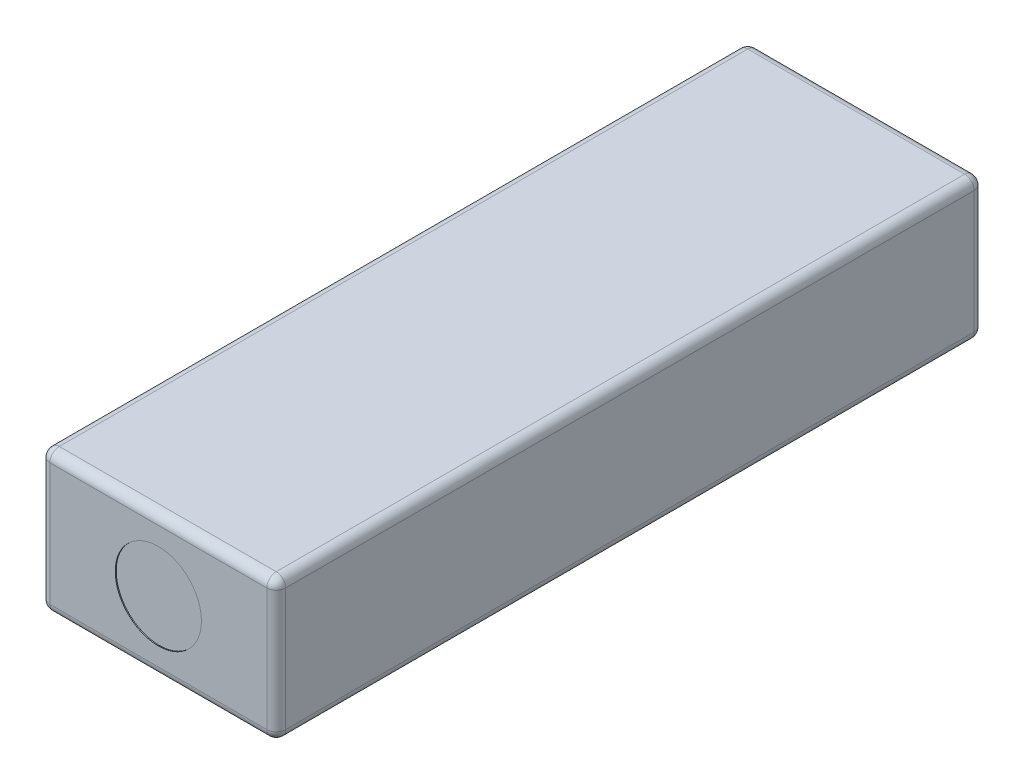
from build123d import *

# Parameters (mm, degrees)
SKETCH2_W           = 50
SKETCH2_H           = 150
BOSS_EXTRUDE1_DEPTH = 30
FILLET1_R           = 2
SKETCH3_R           = 9.140090322
CUT_EXTRUDE1_DEPTH  = 0.2


with BuildPart() as part:
    # Sketch2 → Boss-Extrude1 (new body)
    with BuildSketch(Plane(origin=(0, 0, 0), x_dir=(1, 0, 0), z_dir=(0, 1, 0))):
        Rectangle(SKETCH2_W, SKETCH2_H)
    extrude(amount=BOSS_EXTRUDE1_DEPTH)

    # Fillet1
    fillet1_edges = [part.edges().sort_by_distance(p)[0] for p in [
        (-25, 30, 0),
        (0, 30, 75),
        (25, 30, 0),
        (0, 0, 75),
        (-25, 0, 0),
        (0, 0, -75),
        (25, 0, 0),
        (25, 15, 75),
        (-25, 15, 75),
        (-25, 15, -75),
        (25, 15, -75),
        (0, 30, -75),
    ]]
    fillet(fillet1_edges, radius=FILLET1_R)

    # Sketch3 → Cut-Extrude1 (cut)
    with BuildSketch(Plane.XY.offset(75)):
        with Locations((0, 15)):
            Circle(SKETCH3_R)
    extrude(amount=-CUT_EXTRUDE1_DEPTH, mode=Mode.SUBTRACT)


solid = part.part
